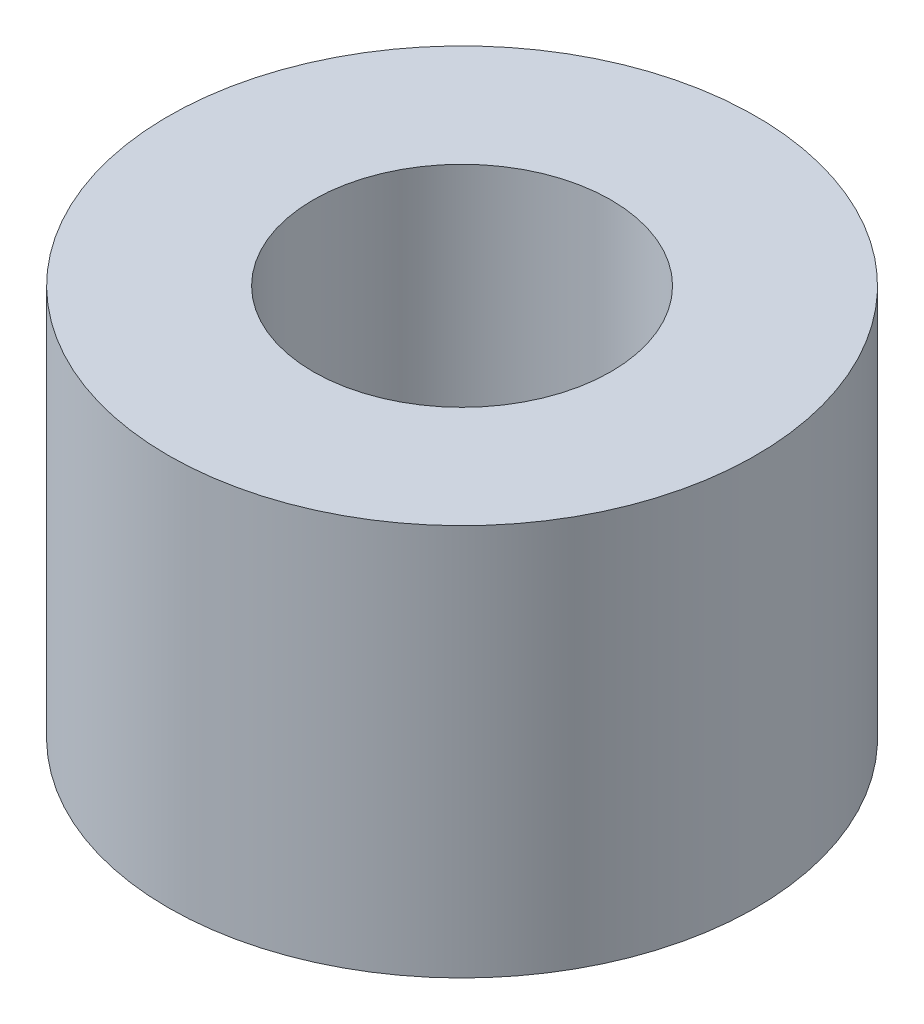
from build123d import *

# Parameters (mm, degrees)
SKETCH1_R           = 4.7625
SKETCH1_R_2         = 2.413
BOSS_EXTRUDE1_DEPTH = 6.35


with BuildPart() as part:
    # Sketch1 → Boss-Extrude1 (new body)
    with BuildSketch(Plane(origin=(0, 0, 0), x_dir=(1, 0, 0), z_dir=(0, 1, 0))):
        with Locations(Location((0, 0, 0), (0, 0, 270))):
            Circle(SKETCH1_R)
        with Locations(Location((0, 0, 0), (0, 0, 270))):
            Circle(SKETCH1_R_2, mode=Mode.SUBTRACT)
    extrude(amount=BOSS_EXTRUDE1_DEPTH)


solid = part.part
